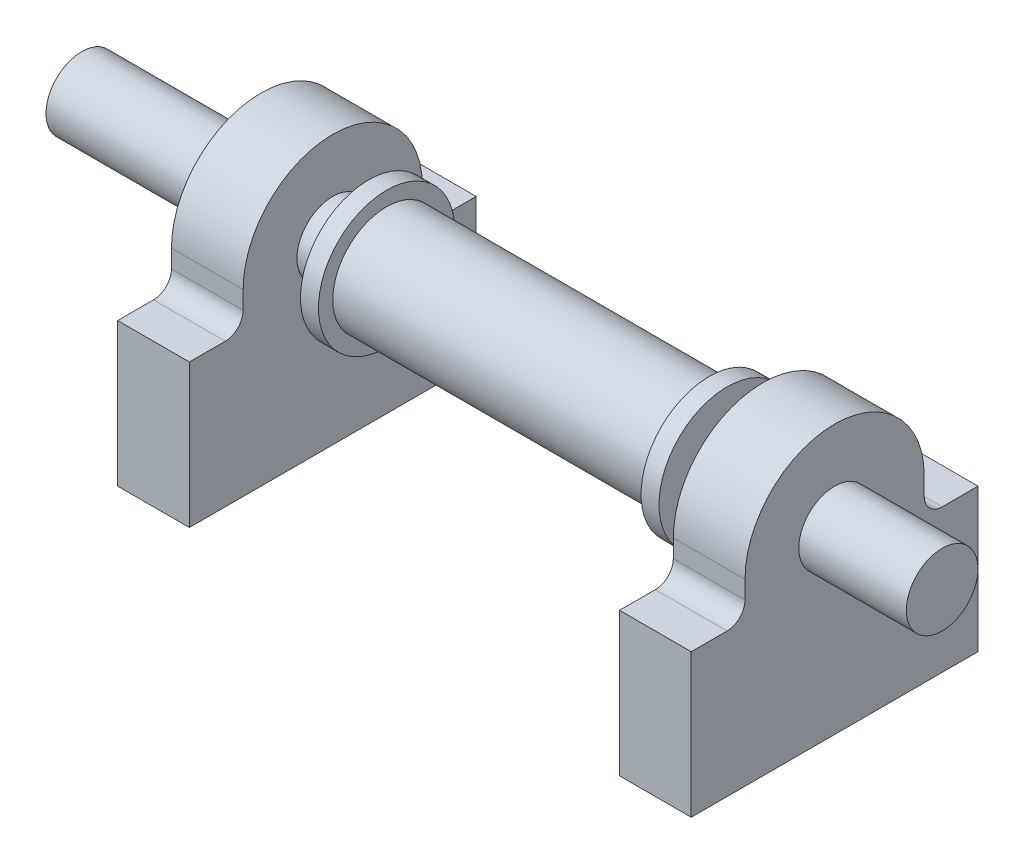
from build123d import *

# Parameters (mm, degrees)
SKETCH1_W                = 20
SKETCH1_H                = 80
BOSS_EXTRUDE1_DEPTH      = 40
BOSS_EXTRUDE1_2_DEPTH    = 40
BOSS_EXTRUDE2_START      = -20
BOSS_EXTRUDE2_DEPTH      = 20
BOSS_EXTRUDE3_START      = -20
BOSS_EXTRUDE3_DEPTH      = 20
SKETCH5_R                = 10
CUT_EXTRUDE2_DEPTH       = 170
FILLET2_R                = 5
FILLET3_R                = 5
BOSS_EXTRUDE4_DEPTH      = 50
BOSS_EXTRUDE4_DEPTH_BACK = 190
SKETCH6_R                = 10
SKETCH10_R               = 19
BOSS_EXTRUDE6_DEPTH      = 5
SKETCH11_R               = 15
BOSS_EXTRUDE7_DEPTH      = 100


with BuildPart() as part:
    # Sketch1 → Boss-Extrude1 (new body)
    with BuildSketch(Plane(origin=(0, 0, 0), x_dir=(1, 0, 0), z_dir=(0, 1, 0))):
        with Locations((70, 0)):
            Rectangle(SKETCH1_W, SKETCH1_H)
    extrude(amount=BOSS_EXTRUDE1_DEPTH)

    # Sketch4 → Boss-Extrude3 (add)
    with BuildSketch(Plane(origin=(80, 0, 0), x_dir=(0, 0, -1), z_dir=(1, 0, 0)).offset(BOSS_EXTRUDE3_START)):
        with BuildLine():
            Line((-25, 50), (-25, 40))
            Line((-25, 40), (25, 40))
            Line((25, 40), (25, 50))
            ThreePointArc((25, 50), (0, 75), (-25, 50))
        make_face()
    extrude(amount=BOSS_EXTRUDE3_DEPTH)


with BuildPart() as body_2:
    # Sketch1 → Boss-Extrude1 2 (new body)
    with BuildSketch(Plane(origin=(0, 0, 0), x_dir=(1, 0, 0), z_dir=(0, 1, 0))):
        with Locations((-70, 0)):
            Rectangle(SKETCH1_W, SKETCH1_H)
    extrude(amount=BOSS_EXTRUDE1_2_DEPTH)

    # Sketch2 → Boss-Extrude2 (add)
    with BuildSketch(Plane.ZY.offset(80).offset(BOSS_EXTRUDE2_START)):
        with BuildLine():
            Line((-25, 50), (-25, 40))
            Line((-25, 40), (25, 40))
            Line((25, 40), (25, 50))
            ThreePointArc((25, 50), (0, 75), (-25, 50))
        make_face()
    extrude(amount=BOSS_EXTRUDE2_DEPTH)


with BuildPart() as cut_extrude2_tool:
    # Sketch5 → Cut-Extrude2 (new body)
    with BuildSketch(Plane.ZY.offset(80)):
        with Locations((0, 50)):
            Circle(SKETCH5_R)
    extrude(amount=-CUT_EXTRUDE2_DEPTH)


with BuildPart() as part_1:
    add(part.part)

    # Cut-Extrude2: cut by cut_extrude2_tool
    add(cut_extrude2_tool.part, mode=Mode.SUBTRACT)

    # Fillet3
    fillet3_edges = [part_1.edges().sort_by_distance(p)[0] for p in [
        (70, 40, -25),
        (70, 40, 25),
    ]]
    fillet(fillet3_edges, radius=FILLET3_R)



with BuildPart() as body_2_1:
    add(body_2.part)

    # Cut-Extrude2: cut by cut_extrude2_tool
    add(cut_extrude2_tool.part, mode=Mode.SUBTRACT)

    # Fillet2
    fillet2_edges = [body_2_1.edges().sort_by_distance(p)[0] for p in [
        (-70, 40, 25),
        (-70, 40, -25),
    ]]
    fillet(fillet2_edges, radius=FILLET2_R)


with BuildPart() as part_2:
    add(part_1.part)

    add(body_2_1.part)  # Boss-Extrude4 merges body 2
    # Sketch6 → Boss-Extrude4 (add, two sides: drawn at the far end of the back side and taken through both)
    with BuildSketch(Plane.ZY.offset(80).offset(-BOSS_EXTRUDE4_DEPTH_BACK)):
        with Locations((0, 50)):
            Circle(SKETCH6_R)
    extrude(amount=BOSS_EXTRUDE4_DEPTH + BOSS_EXTRUDE4_DEPTH_BACK)

    # Sketch10 → Boss-Extrude6 (add)
    with BuildSketch(Plane(origin=(-50, 0, 0), x_dir=(0, 0, -1), z_dir=(1, 0, 0))):
        with Locations((0, 50)):
            Circle(SKETCH10_R)
    boss_extrude6 = extrude(amount=BOSS_EXTRUDE6_DEPTH)

    # Mirror9: Boss-Extrude6 across plane
    add(boss_extrude6.mirror(Plane(origin=(0, 0, 0), x_dir=(0, 0, 1), z_dir=(1, 0, 0))))

    # Sketch11 → Boss-Extrude7 (add)
    with BuildSketch(Plane(origin=(-50, 0, 0), x_dir=(0, 0, -1), z_dir=(1, 0, 0))):
        with Locations(Location((0, 50, 0), (0, 0, 180))):
            Circle(SKETCH11_R)
    extrude(amount=BOSS_EXTRUDE7_DEPTH)


solid = part_2.part
